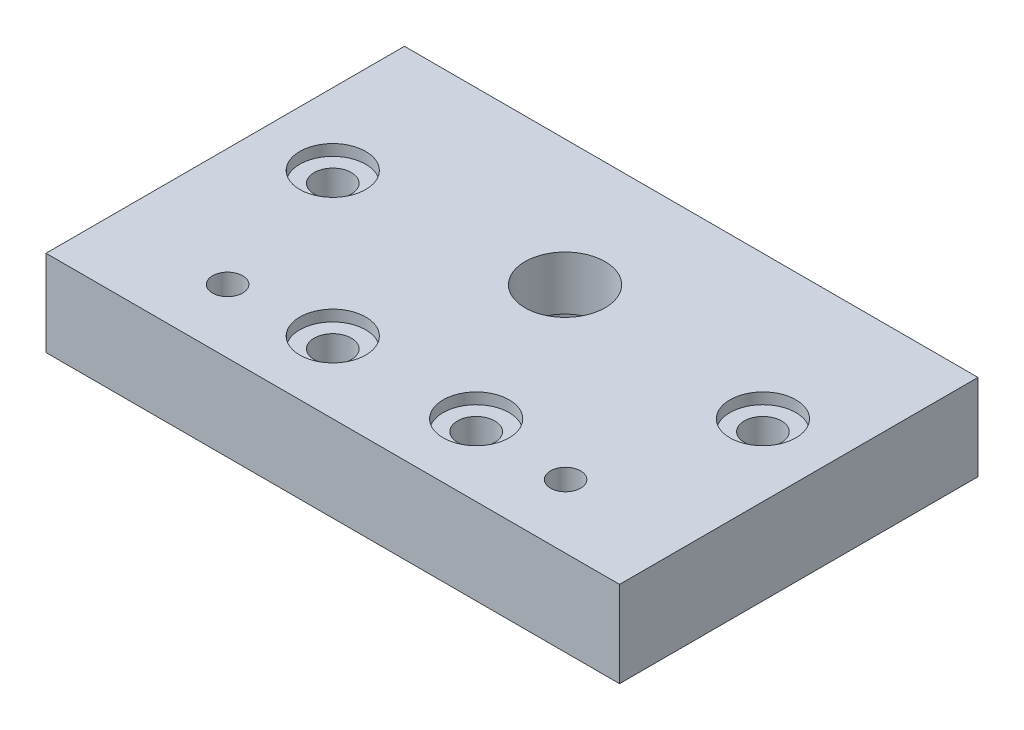
from build123d import *

# Parameters (mm, degrees)
SKETCH1_W                                = 80
SKETCH1_H                                = 50
BOSS_EXTRUDE1_DEPTH                      = 12
HOLE2_AT_2_COUNT                         = 2
HOLE2_AT_2_PITCH                         = 28.284271247
CBORE_FOR_M10_HEX_HEAD_BOLT2_D           = 11.176
CBORE_FOR_M10_HEX_HEAD_BOLT2_CBORE_D     = 16.1
CBORE_FOR_M10_HEX_HEAD_BOLT2_CBORE_DEPTH = 4.5


with BuildPart() as part:
    # Sketch1 → Boss-Extrude1 (new body)
    with BuildSketch(Plane(origin=(0, 0, 0), x_dir=(1, 0, 0), z_dir=(0, 1, 0))):
        Rectangle(SKETCH1_W, SKETCH1_H)
    extrude(amount=BOSS_EXTRUDE1_DEPTH)

    # Sketch9 → Hole2 (revolve, cut)
    with BuildSketch(Plane(origin=(-30, 12, -5), x_dir=(0, 0, 1), z_dir=(1, 0, 0))):
        Polygon((0, 0), (0, 13.562237609), (2.6, 12), (2.6, 1.55), (4.6, 1.55), (4.6, 0), align=None)
    hole2 = revolve(axis=Axis((-30, 23.310875039, -5), (0, -1, 0)), mode=Mode.SUBTRACT)

    # Hole2 at 2: Hole2 ×2
    with Locations(*[Vector(0.7071067811865476, 0, 0.7071067811865475) * (i * HOLE2_AT_2_PITCH) for i in range(1, HOLE2_AT_2_COUNT)]):
        add(hole2, mode=Mode.SUBTRACT)

    # Mirror1: Hole2 across plane
    add(hole2.mirror(Plane(origin=(0, 0, 0), x_dir=(0, 0, 1), z_dir=(1, 0, 0))), mode=Mode.SUBTRACT)

    # Mirror1 copy 1 sketch → Mirror1 copy 1 (revolve, cut)
    with BuildSketch(Plane(origin=(10, 12, 15), x_dir=(0, 0, 1), z_dir=(-1, 0, 0))):
        Polygon((0, 0), (0, -13.562237609), (2.6, -12), (2.6, -1.55), (4.6, -1.55), (4.6, 0), align=None)
    revolve(axis=Axis((10, 23.310875039, 15), (0, 1, 0)), mode=Mode.SUBTRACT)

    # Sketch11 → Ø4.2 (4.2) Diameter Hole1 (revolve, cut)
    with BuildSketch(Plane(origin=(-23.57, 12, 16.1), x_dir=(0, 0, 1), z_dir=(1, 0, 0))):
        Polygon((0, 0), (0, 13.2618073), (2.1, 12), (2.1, 0), align=None)
    f_4_2_4_2_diameter_hole1 = revolve(axis=Axis((-23.57, 18.35, 16.1), (0, -1, 0)), mode=Mode.SUBTRACT)

    # Mirror2: Ø4.2 (4.2) Diameter Hole1 across plane
    add(f_4_2_4_2_diameter_hole1.mirror(Plane(origin=(0, 0, 0), x_dir=(0, 0, 1), z_dir=(1, 0, 0))), mode=Mode.SUBTRACT)

    # CBORE for M10 Hex Head Bolt2 (through all)
    with Locations(Plane(origin=(0, 0, 0), x_dir=(-1, 0, 0), z_dir=(0, -1, 0))):
        with Locations((0, 7.4)):
            CounterBoreHole(CBORE_FOR_M10_HEX_HEAD_BOLT2_D / 2, CBORE_FOR_M10_HEX_HEAD_BOLT2_CBORE_D / 2, CBORE_FOR_M10_HEX_HEAD_BOLT2_CBORE_DEPTH)

    # Sketch21 → Ø4.2 (4.2) Diameter Hole2 (revolve, cut)
    with BuildSketch(Plane(origin=(10, 6, -25), x_dir=(0, 1, 0), z_dir=(1, 0, 0))):
        Polygon((0, 0), (0, 15.2618073), (2.1, 14), (2.1, 0), align=None)
    f_4_2_4_2_diameter_hole2 = revolve(axis=Axis((10, 6, -31.35), (0, 0, 1)), mode=Mode.SUBTRACT)

    # Mirror3: Ø4.2 (4.2) Diameter Hole2 across plane
    add(f_4_2_4_2_diameter_hole2.mirror(Plane(origin=(0, 0, 0), x_dir=(0, 0, 1), z_dir=(1, 0, 0))), mode=Mode.SUBTRACT)


solid = part.part
